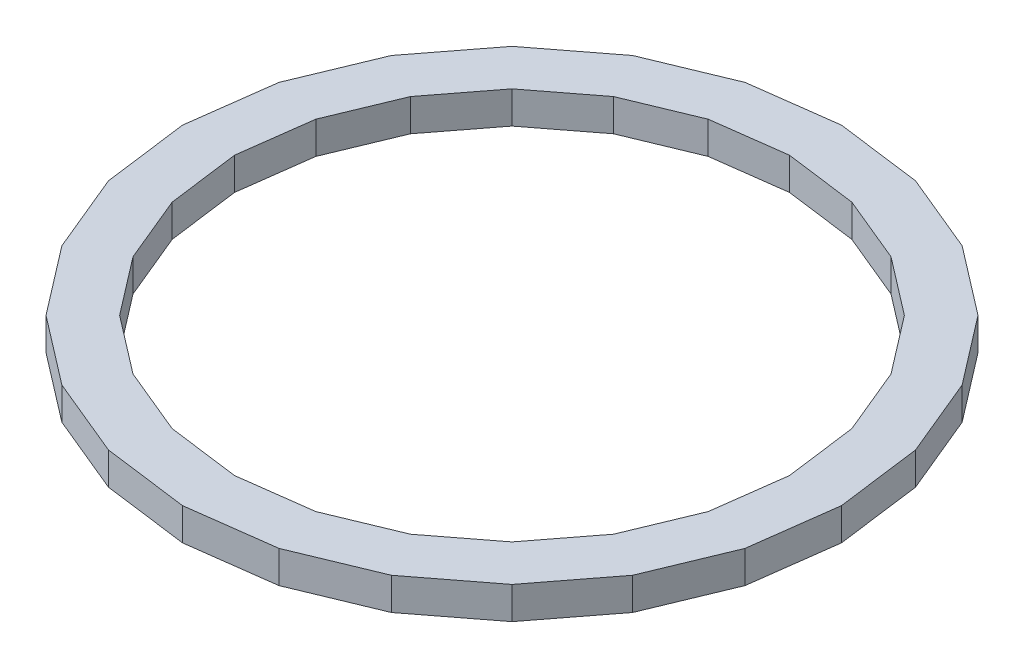
from build123d import *

# Parameters (mm, degrees)
BOSS_EXTRUDE2_DEPTH = 19.05


with BuildPart() as part:
    # Sketch2 → Boss-Extrude2 (new body)
    with BuildSketch(Plane(origin=(0, 0, 0), x_dir=(1, 0, 0), z_dir=(0, 1, 0))):
        Polygon((-194.596958419, 0), (-187.966227854, -50.365398958), (-168.52590949, -97.298479209), (-137.600828896, -137.600828896), (-97.298479209, -168.52590949), (-50.365398958, -187.966227854), (0, -194.596958419), (50.365398958, -187.966227854), (97.298479209, -168.52590949), (137.600828896, -137.600828896), (168.52590949, -97.298479209), (187.966227854, -50.365398958), (194.596958419, 0), (187.966227854, 50.365398958), (168.52590949, 97.298479209), (137.600828896, 137.600828896), (97.298479209, 168.52590949), (50.365398958, 187.966227854), (0, 194.596958419), (-50.365398958, 187.966227854), (-97.298479209, 168.52590949), (-137.600828896, 137.600828896), (-168.52590949, 97.298479209), (-187.966227854, 50.365398958), align=None)
        Polygon((-163.8539477, 0), (-158.270759823, -42.40852228), (-141.901681219, -81.92697385), (-115.862237543, -115.862237543), (-81.92697385, -141.901681219), (-42.40852228, -158.270759823), (0, -163.8539477), (42.40852228, -158.270759823), (81.92697385, -141.901681219), (115.862237543, -115.862237543), (141.901681219, -81.92697385), (158.270759823, -42.40852228), (163.8539477, 0), (158.270759823, 42.40852228), (141.901681219, 81.92697385), (115.862237543, 115.862237543), (81.92697385, 141.901681219), (42.40852228, 158.270759823), (0, 163.8539477), (-42.40852228, 158.270759823), (-81.92697385, 141.901681219), (-115.862237543, 115.862237543), (-141.901681219, 81.92697385), (-158.270759823, 42.40852228), align=None, mode=Mode.SUBTRACT)
    extrude(amount=BOSS_EXTRUDE2_DEPTH)


solid = part.part
